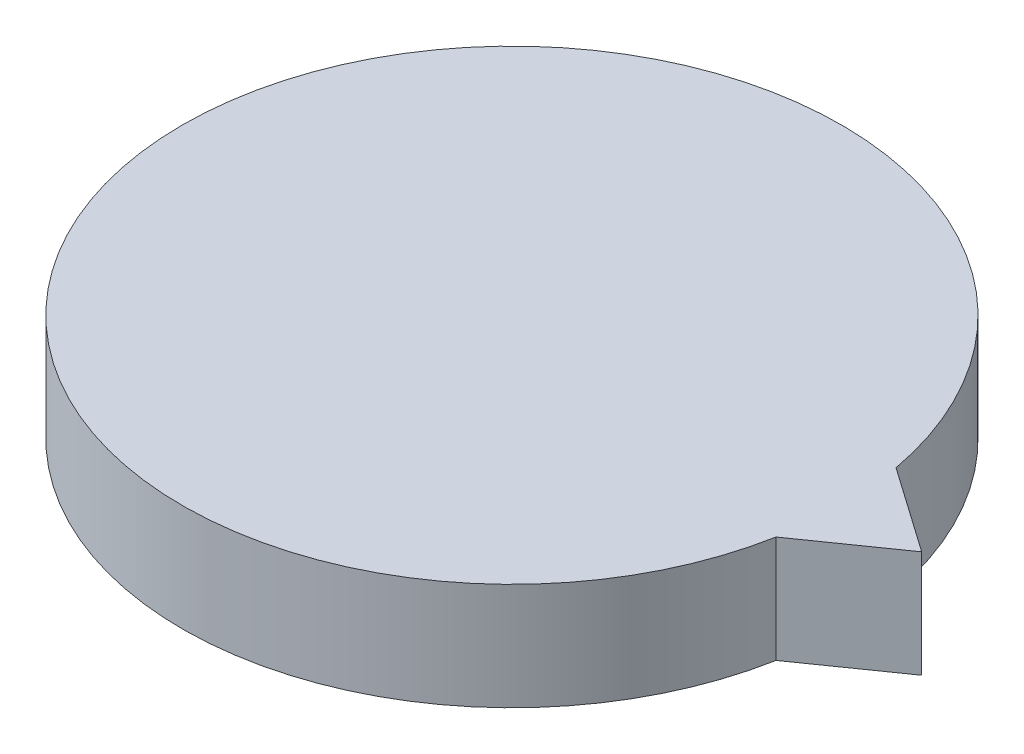
from build123d import *
from build123d.topology import SkipClean

# Parameters (mm, degrees)
SKETCH2_R           = 18.5
BOSS_EXTRUDE1_DEPTH = 3
BOSS_EXTRUDE2_START = 3
SKETCH3_R           = 18.5
SKETCH3_R_2         = 16.5
BOSS_EXTRUDE2_DEPTH = 3
SKETCH4_R           = 5.9
SKETCH4_R_2         = 3.25
BOSS_EXTRUDE3_DEPTH = 5
CUT_EXTRUDE2_DEPTH  = 5
BOSS_EXTRUDE4_DEPTH = 6


with BuildPart() as part:
    # Sketch2 → Boss-Extrude1 (new body)
    with BuildSketch(Plane(origin=(0, 0, 0), x_dir=(1, 0, 0), z_dir=(0, 1, 0))):
        with Locations(Location((0, 0, 0), (0, 0, 270))):
            Circle(SKETCH2_R)
    extrude(amount=BOSS_EXTRUDE1_DEPTH)

    # Sketch3 → Boss-Extrude2 (add)
    with BuildSketch(Plane.XZ.offset(BOSS_EXTRUDE2_START)):
        with Locations(Location((0, 0, 0), (0, 0, 270))):
            Circle(SKETCH3_R)
        with Locations(Location((0, 0, 0), (0, 0, 270))):
            Circle(SKETCH3_R_2, mode=Mode.SUBTRACT)
    extrude(amount=-BOSS_EXTRUDE2_DEPTH)

    # Sketch4 → Boss-Extrude3 (add)
    with BuildSketch(Plane(origin=(0, 3, 0), x_dir=(1, 0, 0), z_dir=(0, 1, 0))):
        with Locations(Location((0, 0, 0), (0, 0, 270))):
            Circle(SKETCH4_R)
        with Locations(Location((0, 0, 0), (0, 0, 270))):
            Circle(SKETCH4_R_2, mode=Mode.SUBTRACT)
    extrude(amount=-BOSS_EXTRUDE3_DEPTH)

    # Sketch5 → Cut-Extrude2 (cut)
    with BuildSketch(Plane.XZ):
        with BuildLine():
            Line((4.59674962, 3.712723487), (1.284790165, 1.037705121))
            Line((1.284790165, 1.037705121), (1.443832634, -0.55633918))
            Line((1.443832634, -0.55633918), (5.513687667, -2.124540202))
            ThreePointArc((5.513687667, -2.124540202), (5.837263689, 0.916938047), (4.59674962, 3.712723487))
        make_face()
        with BuildLine():
            Line((-0.766702536, -0.619253766), (-4.59674962, -3.712723487))
            ThreePointArc((-4.59674962, -3.712723487), (-2.124540202, -5.513687667), (0.916938047, -5.837263689))
            Line((0.916938047, -5.837263689), (0.150426378, -0.957620244))
            Line((0.150426378, -0.957620244), (-0.766702536, -0.619253766))
        make_face()
        with BuildLine():
            Line((-0.209377738, 1.332906921), (-0.916938047, 5.837263689))
            ThreePointArc((-0.916938047, 5.837263689), (-3.712723487, 4.59674962), (-5.513687667, 2.124540202))
            Line((-5.513687667, 2.124540202), (-1.089014646, 0.419620322))
            Line((-1.089014646, 0.419620322), (-0.209377738, 1.332906921))
        make_face()
    extrude(amount=CUT_EXTRUDE2_DEPTH, mode=Mode.SUBTRACT)

    # Sketch6 → Boss-Extrude4 (add)
    with SkipClean():  # the faces are left unmerged after this step: merging them gives an invalid solid
        with BuildSketch(Plane(origin=(0, 3, 0), x_dir=(1, 0, 0), z_dir=(0, 1, 0))):
            Polygon((18.190962826, 3.367324081), (18.190962826, -3.367324081), (23, 0), align=None)
        extrude(amount=-BOSS_EXTRUDE4_DEPTH)


solid = part.part
